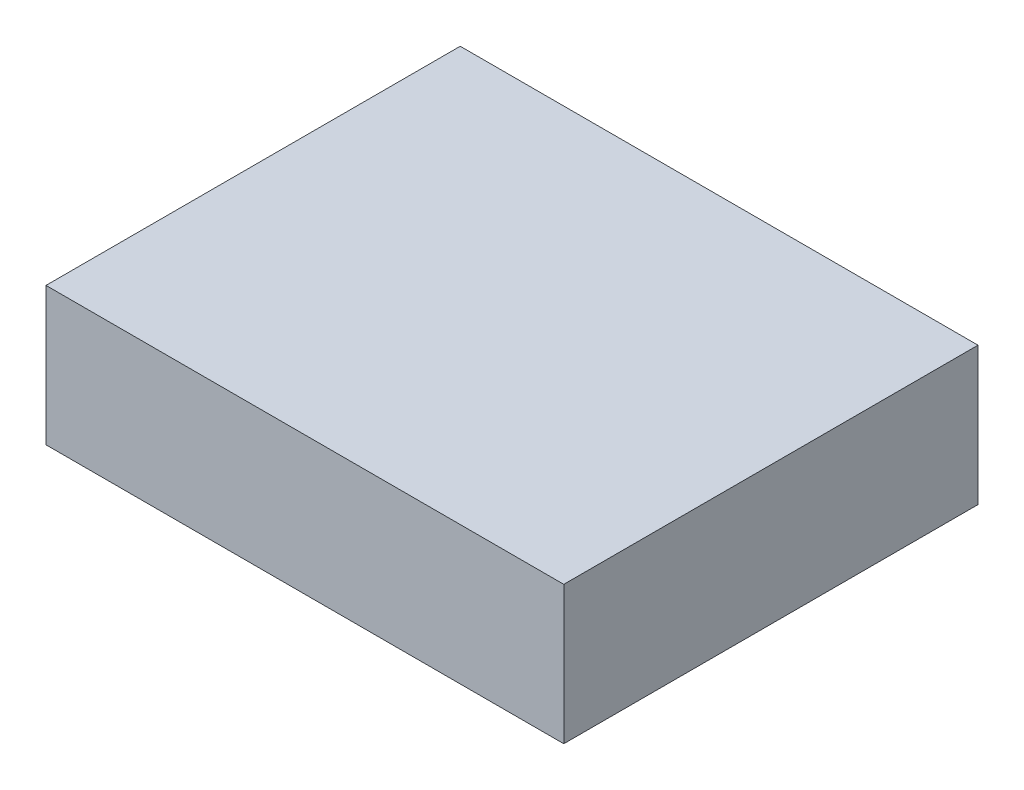
from build123d import *

# Parameters (mm, degrees)
SKETCH1_W           = 38.1
SKETCH1_H           = 30.48
BOSS_EXTRUDE1_DEPTH = 10.16
SKETCH3_R           = 1.65
CUT_EXTRUDE1_DEPTH  = 10


with BuildPart() as part:
    # Sketch1 → Boss-Extrude1 (new body)
    with BuildSketch(Plane(origin=(0, 0, 0), x_dir=(1, 0, 0), z_dir=(0, 1, 0))):
        Rectangle(SKETCH1_W, SKETCH1_H)
    extrude(amount=BOSS_EXTRUDE1_DEPTH)

    # Sketch3 → Cut-Extrude1 (cut)
    with BuildSketch(Plane.XZ):
        with Locations(Location((0, 7.62, 0), (0, 0, 270))):
            Circle(SKETCH3_R)
        with Locations(Location((0, -7.62, 0), (0, 0, 270))):
            Circle(SKETCH3_R)
    extrude(amount=-CUT_EXTRUDE1_DEPTH, mode=Mode.SUBTRACT)


solid = part.part
